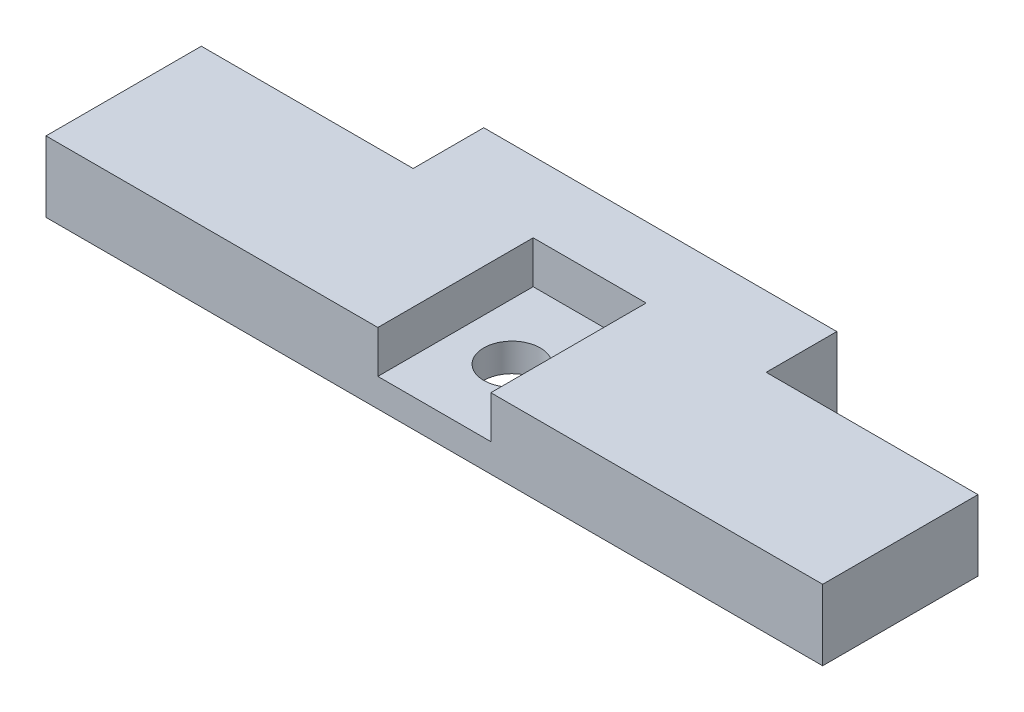
from build123d import *

# Parameters (mm, degrees)
BOSS_EXTRU_1_DEPTH      = 5
ESQUISSE2_W             = 8
ESQUISSE2_H             = 11
ENL_V_MAT_EXTRU_5_DEPTH = 3
ESQUISSE3_R             = 2
ENL_V_MAT_EXTRU_6_DEPTH = 29.7967012


with BuildPart() as part:
    # Esquisse1 → Boss.-Extru.1 (new body)
    with BuildSketch(Plane(origin=(0, 0, 0), x_dir=(1, 0, 0), z_dir=(0, 1, 0))):
        Polygon((-12.5, 8), (-12.5, 3), (-27.5, 3), (-27.5, -8), (27.5, -8), (27.5, 3), (12.5, 3), (12.5, 8), align=None)
    extrude(amount=BOSS_EXTRU_1_DEPTH)

    # Esquisse2 → Enlèv. mat.-Extru.5 (cut)
    with BuildSketch(Plane(origin=(0, 5, 0), x_dir=(1, 0, 0), z_dir=(0, 1, 0))):
        with Locations((0, -2.5)):
            Rectangle(ESQUISSE2_W, ESQUISSE2_H)
    extrude(amount=-ENL_V_MAT_EXTRU_5_DEPTH, mode=Mode.SUBTRACT)

    # Esquisse3 → Enlèv. mat.-Extru.6 (cut, through all)
    with BuildSketch(Plane(origin=(0, 2, 0), x_dir=(1, 0, 0), z_dir=(0, 1, 0))):
        with Locations(Location((0, -2.5, 0), (0, 0, 270))):
            Circle(ESQUISSE3_R)
    extrude(amount=-ENL_V_MAT_EXTRU_6_DEPTH, mode=Mode.SUBTRACT)


solid = part.part
